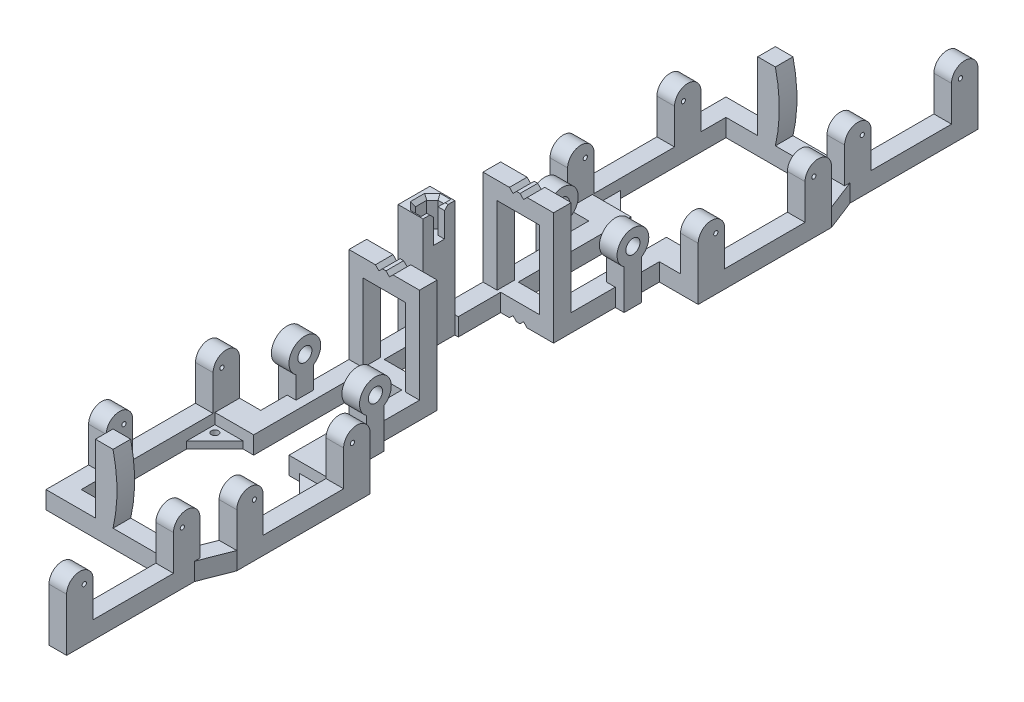
from build123d import *

# Parameters (mm, degrees)
SKETCH_2_5_W               = 5
SKETCH_2_5_H               = 5
RAIL1_DEPTH                = 27.5
ARCHFORTHREAD1_DEPTH       = 2.5
RAIL2_DEPTH                = 2.5
SKETCH_3_W                 = 5
SKETCH_3_H                 = 5
CELLNEST_DEPTH             = 14.5
SKETCH_4_W                 = 7.05
SKETCH_4_H                 = 9
EXTRUDE_6_DEPTH            = 25
EXTRUDE_7_DEPTH            = 8
CHAMFER_1_SIZE             = 1
SKETCH_7_R                 = 2
EXTRUDE_8_DEPTH            = 2.5
SKETCH_12_W                = 16
SKETCH_12_H                = 7
EXTRUDE_9_DEPTH            = 5
SKETCH_13_R                = 0.6
EXTRUDE_10_DEPTH           = 5
EXTRUDE_11_DEPTH           = 5
PATTERN_LINEAR_1_COUNT     = 2
PATTERN_LINEAR_1_PITCH     = 45
EXTRUDE_12_DEPTH           = 5
EXTRUDE_13_DEPTH           = 5
MIRROR_13_COPY_1_DEPTH     = 2.5
MIRROR_13_COPY_2_DEPTH     = 2.5
MIRROR_21_COPY_1_SKETCH_W  = 5
MIRROR_21_COPY_1_SKETCH_H  = 5
MIRROR_21_COPY_1_DEPTH     = 27.5
MIRROR_21_COPY_2_SKETCH_W  = 5
MIRROR_21_COPY_2_SKETCH_H  = 5
MIRROR_21_COPY_2_DEPTH     = 27.5
MIRROR_21_COPY_3_DEPTH     = 2.5
MIRROR_21_COPY_4_DEPTH     = 2.5
MIRROR_22_COPY_1_SKETCH_R  = 2
MIRROR_22_COPY_1_DEPTH     = 2.5
MIRROR_22_COPY_2_SKETCH_R  = 2
MIRROR_22_COPY_2_DEPTH     = 2.5
MIRROR_23_COPY_1_SKETCH_W  = 16
MIRROR_23_COPY_1_SKETCH_H  = 7
MIRROR_23_COPY_1_DEPTH     = 5
MIRROR_23_COPY_2_SKETCH_R  = 0.6
MIRROR_23_COPY_2_DEPTH     = 5
MIRROR_23_COPY_3_SKETCH_W  = 16
MIRROR_23_COPY_3_SKETCH_H  = 7
MIRROR_23_COPY_3_DEPTH     = 5
MIRROR_23_COPY_4_SKETCH_R  = 0.6
MIRROR_23_COPY_4_DEPTH     = 5
MIRROR_25_COPY_1_SKETCH_R  = 0.6
MIRROR_25_COPY_1_DEPTH     = 5
MIRROR_25_COPY_2_SKETCH_R  = 0.6
MIRROR_25_COPY_2_DEPTH     = 5
SKETCH_18_R                = 1
EXTRUDE_14_DEPTH           = 2
MIRROR_2_2_COPY_1_SKETCH_R = 1
MIRROR_2_2_COPY_1_DEPTH    = 2
MIRROR_2_2_COPY_2_SKETCH_R = 1
MIRROR_2_2_COPY_2_DEPTH    = 2


with BuildPart() as part:
    # Эскиз2<5> → Rail1 (new body)
    with BuildSketch(Plane.XY):
        with Locations((7.5, 2.5)):
            Rectangle(SKETCH_2_5_W, SKETCH_2_5_H)
    rail1 = extrude(amount=-RAIL1_DEPTH)

    # Эскиз2 → ArchForThread1 (add, symmetric)
    with BuildSketch(Plane.XY):
        Polygon((0, 5), (0, 0), (0.5, 0), (1.5, 1), (2.5, 0), (5, 0), (5, 5), align=None)
        Polygon((6, 27), (6, 5), (10, 5), (10, 32), (2.5, 32), (1.5, 31), (0.5, 32), (0, 32), (0, 27), align=None)
    archforthread1 = extrude(amount=ARCHFORTHREAD1_DEPTH, both=True)

    # Mirror 2: ArchForThread1 across plane
    add(archforthread1.mirror(Plane(origin=(0, 0, 0), x_dir=(0, 0, 1), z_dir=(1, 0, 0))))

    # Зеркальное отражение3: Rail1 across plane
    add(rail1.mirror(Plane(origin=(0, 0, 0), x_dir=(0, 0, 1), z_dir=(1, 0, 0))))

    # Эскиз2<6> → Rail2 (add)
    with BuildSketch(Plane.XY):
        Polygon((6, 5), (5, 5), (5, 0), (10, 0), (10, 5), align=None)
    rail2 = extrude(amount=RAIL2_DEPTH)

    # Эскиз3 → CellNest (add)
    with BuildSketch(Plane.XY):
        with Locations((-7.5, 2.5)):
            Rectangle(SKETCH_3_W, SKETCH_3_H)
    cellnest = extrude(amount=CELLNEST_DEPTH)

    # Эскиз4 → Бобышка-Вытянуть6 (add)
    with BuildSketch(Plane(origin=(0, 0, 0), x_dir=(1, 0, 0), z_dir=(0, 1, 0))):
        with Locations((-9.525, -19)):
            Rectangle(SKETCH_4_W, SKETCH_4_H)
    extrude(amount=EXTRUDE_6_DEPTH)

    # Эскиз5 → Бобышка-Вытянуть7 (add)
    with BuildSketch(Plane(origin=(0, 25, 0), x_dir=(1, 0, 0), z_dir=(0, 1, 0))):
        Polygon((-13.05, -23.5), (-6, -23.5), (-6, -20.6), (-7.85, -20.6), (-7.85, -22.2), (-9.45, -22.2), (-11.05, -20.6), (-11.05, -17.4), (-9.45, -15.8), (-7.85, -15.8), (-7.85, -17.4), (-6, -17.4), (-6, -14.5), (-13.05, -14.5), align=None)
    extrude(amount=EXTRUDE_7_DEPTH)

    # Фаска1
    chamfer_1_edges = [part.edges().sort_by_distance(p)[0] for p in [
        (-6.925, 33, 20.6),
        (-7.85, 33, 21.4),
        (-8.65, 33, 22.2),
        (-10.25, 33, 21.4),
        (-6.925, 33, 17.4),
        (-7.85, 33, 16.6),
        (-8.65, 33, 15.8),
        (-10.25, 33, 16.6),
        (-11.05, 33, 19),
    ]]
    chamfer(chamfer_1_edges, length=CHAMFER_1_SIZE)

    # Эскиз7 → Бобышка-Вытянуть8 (add, symmetric)
    with BuildSketch(Plane(origin=(10, 0, 0), x_dir=(0, 0, -1), z_dir=(1, 0, 0))):
        with BuildLine():
            Line((20, 11.258342613), (20, 0))
            Line((20, 0), (15, 0))
            Line((15, 0), (15, 11.258342613))
            ThreePointArc((15, 11.258342613), (17.5, 19.5), (20, 11.258342613))
        make_face()
        with Locations((17.5, 15)):
            Circle(SKETCH_7_R, mode=Mode.SUBTRACT)
    extrude_8 = extrude(amount=EXTRUDE_8_DEPTH, both=True)

    # Зеркальное отражение4: Бобышка-Вытянуть8 across plane
    add(extrude_8.mirror(Plane(origin=(0, 0, 0), x_dir=(0, 0, 1), z_dir=(1, 0, 0))))

    # Эскиз12 → Бобышка-Вытянуть9 (add)
    with BuildSketch(Plane(origin=(0, 0, 0), x_dir=(1, 0, 0), z_dir=(0, 1, 0))):
        with Locations((13, 31)):
            Rectangle(SKETCH_12_W, SKETCH_12_H)
    extrude_9 = extrude(amount=EXTRUDE_9_DEPTH)

    # Эскиз13 → Бобышка-Вытянуть10 (add)
    with BuildSketch(Plane(origin=(21, 0, 0), x_dir=(0, 0, -1), z_dir=(1, 0, 0))):
        with BuildLine():
            Line((27.5, 0), (65.3, 0))
            Line((65.3, 0), (65.3, 15))
            ThreePointArc((65.3, 15), (61.55, 18.75), (57.8, 15))
            Line((57.8, 15), (57.8, 5))
            Line((57.8, 5), (35, 5))
            Line((35, 5), (35, 15))
            ThreePointArc((35, 15), (31.25, 18.75), (27.5, 15))
            Line((27.5, 15), (27.5, 0))
        make_face()
        with Locations((32.5, 15)):
            Circle(SKETCH_13_R, mode=Mode.SUBTRACT)
        with Locations((60.3, 15)):
            Circle(SKETCH_13_R, mode=Mode.SUBTRACT)
    extrude_10 = extrude(amount=-EXTRUDE_10_DEPTH)

    # Зеркальное отражение5: Бобышка-Вытянуть9, Бобышка-Вытянуть10 across plane
    add(extrude_9.mirror(Plane(origin=(0, 0, 0), x_dir=(0, 0, 1), z_dir=(1, 0, 0))))
    add(extrude_10.mirror(Plane(origin=(0, 0, 0), x_dir=(0, 0, 1), z_dir=(1, 0, 0))))

    # Эскиз14 → Бобышка-Вытянуть11 (add)
    with BuildSketch(Plane(origin=(0, 0, 0), x_dir=(1, 0, 0), z_dir=(0, 1, 0))):
        Polygon((21, 65.3), (17.5, 74.3), (12.5, 74.3), (16, 65.3), align=None)
    extrude_11 = extrude(amount=EXTRUDE_11_DEPTH)

    # Линейный массив1: Бобышка-Вытянуть10 ×2
    with Locations(*[Vector(-0.07457805825848672, 0, -0.9972151789991937) * (i * PATTERN_LINEAR_1_PITCH) for i in range(1, PATTERN_LINEAR_1_COUNT)]):
        add(extrude_10)

    # Эскиз15 → Бобышка-Вытянуть12 (add)
    with BuildSketch(Plane(origin=(0, 0, 0), x_dir=(1, 0, 0), z_dir=(0, 1, 0))):
        Polygon((13.248734368, 72.374683055), (-16, 72.374683055), (-16, 65.3), (-21.000237038, 65.3), (-21.000237038, 72.374683055), (-21.000237038, 77.374683055), (13.248734368, 77.374683055), align=None)
    extrude_12 = extrude(amount=EXTRUDE_12_DEPTH)

    # Эскиз16 → Бобышка-Вытянуть13 (add)
    with BuildSketch(Plane(origin=(0, 0, -77.374683055), x_dir=(-1, 0, 0), z_dir=(0, 0, -1))):
        with BuildLine():
            Line((7.000237038, 24.370480215), (2.000237038, 24.370480215))
            ThreePointArc((2.000237038, 24.370480215), (0.881288878, 14.685240107), (2.000237038, 5))
            Line((2.000237038, 5), (7.000237038, 5))
            Line((7.000237038, 5), (7.000237038, 24.370480215))
        make_face()
    extrude_13 = extrude(amount=-EXTRUDE_13_DEPTH)

    # Зеркальное отражение8: CellNest across plane
    add(cellnest.mirror(Plane.XY.offset(19)))

    # Зеркальное отражение13 copy 1 sketch → Зеркальное отражение13 copy 1 (add, symmetric)
    with BuildSketch(Plane(origin=(0, 0, 38), x_dir=(-1, 0, 0), z_dir=(0, 0, -1))):
        Polygon((0, 5), (0, 0), (0.5, 0), (1.5, 1), (2.5, 0), (5, 0), (5, 5), align=None)
        Polygon((6, 27), (6, 5), (10, 5), (10, 32), (2.5, 32), (1.5, 31), (0.5, 32), (0, 32), (0, 27), align=None)
    extrude(amount=MIRROR_13_COPY_1_DEPTH, both=True)

    # Зеркальное отражение13 copy 2 sketch → Зеркальное отражение13 copy 2 (add, symmetric)
    with BuildSketch(Plane(origin=(0, 0, 38), x_dir=(1, 0, 0), z_dir=(0, 0, -1))):
        Polygon((0, -5), (0, 0), (0.5, 0), (1.5, -1), (2.5, 0), (5, 0), (5, -5), align=None)
        Polygon((6, -27), (6, -5), (10, -5), (10, -32), (2.5, -32), (1.5, -31), (0.5, -32), (0, -32), (0, -27), align=None)
    extrude(amount=MIRROR_13_COPY_2_DEPTH, both=True)

    # Зеркальное отражение19: Rail1 across plane
    add(rail1.mirror(Plane.XY.offset(19)))

    # Зеркальное отражение20: Rail2 across plane
    add(rail2.mirror(Plane.XY.offset(19)))

    # Зеркальное отражение21 copy 1 sketch → Зеркальное отражение21 copy 1 (add)
    with BuildSketch(Plane(origin=(0, 0, 38), x_dir=(-1, 0, 0), z_dir=(0, 0, -1))):
        with Locations((7.5, 2.5)):
            Rectangle(MIRROR_21_COPY_1_SKETCH_W, MIRROR_21_COPY_1_SKETCH_H)
    extrude(amount=-MIRROR_21_COPY_1_DEPTH)

    # Зеркальное отражение21 copy 2 sketch → Зеркальное отражение21 copy 2 (add)
    with BuildSketch(Plane(origin=(0, 0, 0), x_dir=(-1, 0, 0), z_dir=(0, 0, 1))):
        with Locations((7.5, -2.5)):
            Rectangle(MIRROR_21_COPY_2_SKETCH_W, MIRROR_21_COPY_2_SKETCH_H)
    extrude(amount=-MIRROR_21_COPY_2_DEPTH)

    # Зеркальное отражение21 copy 3 sketch → Зеркальное отражение21 copy 3 (add)
    with BuildSketch(Plane(origin=(0, 0, 38), x_dir=(-1, 0, 0), z_dir=(0, 0, -1))):
        Polygon((6, 5), (5, 5), (5, 0), (10, 0), (10, 5), align=None)
    extrude(amount=MIRROR_21_COPY_3_DEPTH)

    # Зеркальное отражение21 copy 4 sketch → Зеркальное отражение21 copy 4 (add)
    with BuildSketch(Plane(origin=(0, 0, 0), x_dir=(-1, 0, 0), z_dir=(0, 0, 1))):
        Polygon((6, -5), (5, -5), (5, 0), (10, 0), (10, -5), align=None)
    extrude(amount=MIRROR_21_COPY_4_DEPTH)

    # Зеркальное отражение22 copy 1 sketch → Зеркальное отражение22 copy 1 (add, symmetric)
    with BuildSketch(Plane(origin=(-10, 0, 38), x_dir=(0, 0, 1), z_dir=(-1, 0, 0))):
        with BuildLine():
            Line((20, 11.258342613), (20, 0))
            Line((20, 0), (15, 0))
            Line((15, 0), (15, 11.258342613))
            ThreePointArc((15, 11.258342613), (17.5, 19.5), (20, 11.258342613))
        make_face()
        with Locations((17.5, 15)):
            Circle(MIRROR_22_COPY_1_SKETCH_R, mode=Mode.SUBTRACT)
    extrude(amount=MIRROR_22_COPY_1_DEPTH, both=True)

    # Зеркальное отражение22 copy 2 sketch → Зеркальное отражение22 copy 2 (add, symmetric)
    with BuildSketch(Plane(origin=(10, 0, 38), x_dir=(0, 0, 1), z_dir=(1, 0, 0))):
        with BuildLine():
            Line((20, -11.258342613), (20, 0))
            Line((20, 0), (15, 0))
            Line((15, 0), (15, -11.258342613))
            ThreePointArc((15, -11.258342613), (17.5, -19.5), (20, -11.258342613))
        make_face()
        with Locations((17.5, -15)):
            Circle(MIRROR_22_COPY_2_SKETCH_R, mode=Mode.SUBTRACT)
    extrude(amount=MIRROR_22_COPY_2_DEPTH, both=True)

    # Зеркальное отражение23 copy 1 sketch → Зеркальное отражение23 copy 1 (add)
    with BuildSketch(Plane(origin=(0, 0, 38), x_dir=(-1, 0, 0), z_dir=(0, 1, 0))):
        with Locations((13, 31)):
            Rectangle(MIRROR_23_COPY_1_SKETCH_W, MIRROR_23_COPY_1_SKETCH_H)
    extrude(amount=MIRROR_23_COPY_1_DEPTH)

    # Зеркальное отражение23 copy 2 sketch → Зеркальное отражение23 copy 2 (add)
    with BuildSketch(Plane(origin=(-21, 0, 38), x_dir=(0, 0, 1), z_dir=(-1, 0, 0))):
        with BuildLine():
            Line((27.5, 0), (65.3, 0))
            Line((65.3, 0), (65.3, 15))
            ThreePointArc((65.3, 15), (61.55, 18.75), (57.8, 15))
            Line((57.8, 15), (57.8, 5))
            Line((57.8, 5), (35, 5))
            Line((35, 5), (35, 15))
            ThreePointArc((35, 15), (31.25, 18.75), (27.5, 15))
            Line((27.5, 15), (27.5, 0))
        make_face()
        with Locations((32.5, 15)):
            Circle(MIRROR_23_COPY_2_SKETCH_R, mode=Mode.SUBTRACT)
        with Locations((60.3, 15)):
            Circle(MIRROR_23_COPY_2_SKETCH_R, mode=Mode.SUBTRACT)
    extrude(amount=-MIRROR_23_COPY_2_DEPTH)

    # Зеркальное отражение23 copy 3 sketch → Зеркальное отражение23 copy 3 (add)
    with BuildSketch(Plane(origin=(0, 0, 38), x_dir=(1, 0, 0), z_dir=(0, 1, 0))):
        with Locations((13, -31)):
            Rectangle(MIRROR_23_COPY_3_SKETCH_W, MIRROR_23_COPY_3_SKETCH_H)
    extrude(amount=MIRROR_23_COPY_3_DEPTH)

    # Зеркальное отражение23 copy 4 sketch → Зеркальное отражение23 copy 4 (add)
    with BuildSketch(Plane(origin=(21, 0, 38), x_dir=(0, 0, 1), z_dir=(1, 0, 0))):
        with BuildLine():
            Line((27.5, 0), (65.3, 0))
            Line((65.3, 0), (65.3, -15))
            ThreePointArc((65.3, -15), (61.55, -18.75), (57.8, -15))
            Line((57.8, -15), (57.8, -5))
            Line((57.8, -5), (35, -5))
            Line((35, -5), (35, -15))
            ThreePointArc((35, -15), (31.25, -18.75), (27.5, -15))
            Line((27.5, -15), (27.5, 0))
        make_face()
        with Locations((32.5, -15)):
            Circle(MIRROR_23_COPY_4_SKETCH_R, mode=Mode.SUBTRACT)
        with Locations((60.3, -15)):
            Circle(MIRROR_23_COPY_4_SKETCH_R, mode=Mode.SUBTRACT)
    extrude(amount=-MIRROR_23_COPY_4_DEPTH)

    # Зеркальное отражение24: Бобышка-Вытянуть11 across plane
    add(extrude_11.mirror(Plane.XY.offset(19)))

    # Зеркальное отражение25 copy 1 sketch → Зеркальное отражение25 copy 1 (add)
    with BuildSketch(Plane(origin=(17.643987378, 0, 82.874683055), x_dir=(0, 0, 1), z_dir=(1, 0, 0))):
        with BuildLine():
            Line((27.5, 0), (65.3, 0))
            Line((65.3, 0), (65.3, -15))
            ThreePointArc((65.3, -15), (61.55, -18.75), (57.8, -15))
            Line((57.8, -15), (57.8, -5))
            Line((57.8, -5), (35, -5))
            Line((35, -5), (35, -15))
            ThreePointArc((35, -15), (31.25, -18.75), (27.5, -15))
            Line((27.5, -15), (27.5, 0))
        make_face()
        with Locations((32.5, -15)):
            Circle(MIRROR_25_COPY_1_SKETCH_R, mode=Mode.SUBTRACT)
        with Locations((60.3, -15)):
            Circle(MIRROR_25_COPY_1_SKETCH_R, mode=Mode.SUBTRACT)
    extrude(amount=-MIRROR_25_COPY_1_DEPTH)

    # Зеркальное отражение25 copy 2 sketch → Зеркальное отражение25 copy 2 (add)
    with BuildSketch(Plane(origin=(21, 0, 38), x_dir=(0, 0, 1), z_dir=(1, 0, 0))):
        with BuildLine():
            Line((27.5, 0), (65.3, 0))
            Line((65.3, 0), (65.3, -15))
            ThreePointArc((65.3, -15), (61.55, -18.75), (57.8, -15))
            Line((57.8, -15), (57.8, -5))
            Line((57.8, -5), (35, -5))
            Line((35, -5), (35, -15))
            ThreePointArc((35, -15), (31.25, -18.75), (27.5, -15))
            Line((27.5, -15), (27.5, 0))
        make_face()
        with Locations((32.5, -15)):
            Circle(MIRROR_25_COPY_2_SKETCH_R, mode=Mode.SUBTRACT)
        with Locations((60.3, -15)):
            Circle(MIRROR_25_COPY_2_SKETCH_R, mode=Mode.SUBTRACT)
    extrude(amount=-MIRROR_25_COPY_2_DEPTH)

    # Зеркальное отражение26: Бобышка-Вытянуть12, Бобышка-Вытянуть13 across plane
    add(extrude_12.mirror(Plane.XY.offset(19)))
    add(extrude_13.mirror(Plane.XY.offset(19)))

    # Эскиз18 → Бобышка-Вытянуть14 (add)
    with BuildSketch(Plane(origin=(0, 0, 0), x_dir=(1, 0, 0), z_dir=(0, 1, 0))):
        Polygon((16, 34.5), (8, 34.5), (16, 42.5), align=None)
        with Locations((14, 36.5)):
            Circle(SKETCH_18_R, mode=Mode.SUBTRACT)
    extrude_14 = extrude(amount=EXTRUDE_14_DEPTH)

    # Mirror 5154: Бобышка-Вытянуть14 across plane
    add(extrude_14.mirror(Plane(origin=(0, 0, 0), x_dir=(0, 0, 1), z_dir=(1, 0, 0))))

    # Mirror 2 2 copy 1 sketch → Mirror 2 2 copy 1 (add)
    with BuildSketch(Plane(origin=(0, 0, 38), x_dir=(-1, 0, 0), z_dir=(0, 1, 0))):
        Polygon((16, 34.5), (8, 34.5), (16, 42.5), align=None)
        with Locations((14, 36.5)):
            Circle(MIRROR_2_2_COPY_1_SKETCH_R, mode=Mode.SUBTRACT)
    extrude(amount=MIRROR_2_2_COPY_1_DEPTH)

    # Mirror 2 2 copy 2 sketch → Mirror 2 2 copy 2 (add)
    with BuildSketch(Plane(origin=(0, 0, 38), x_dir=(1, 0, 0), z_dir=(0, 1, 0))):
        Polygon((16, -34.5), (8, -34.5), (16, -42.5), align=None)
        with Locations((14, -36.5)):
            Circle(MIRROR_2_2_COPY_2_SKETCH_R, mode=Mode.SUBTRACT)
    extrude(amount=MIRROR_2_2_COPY_2_DEPTH)


solid = part.part
